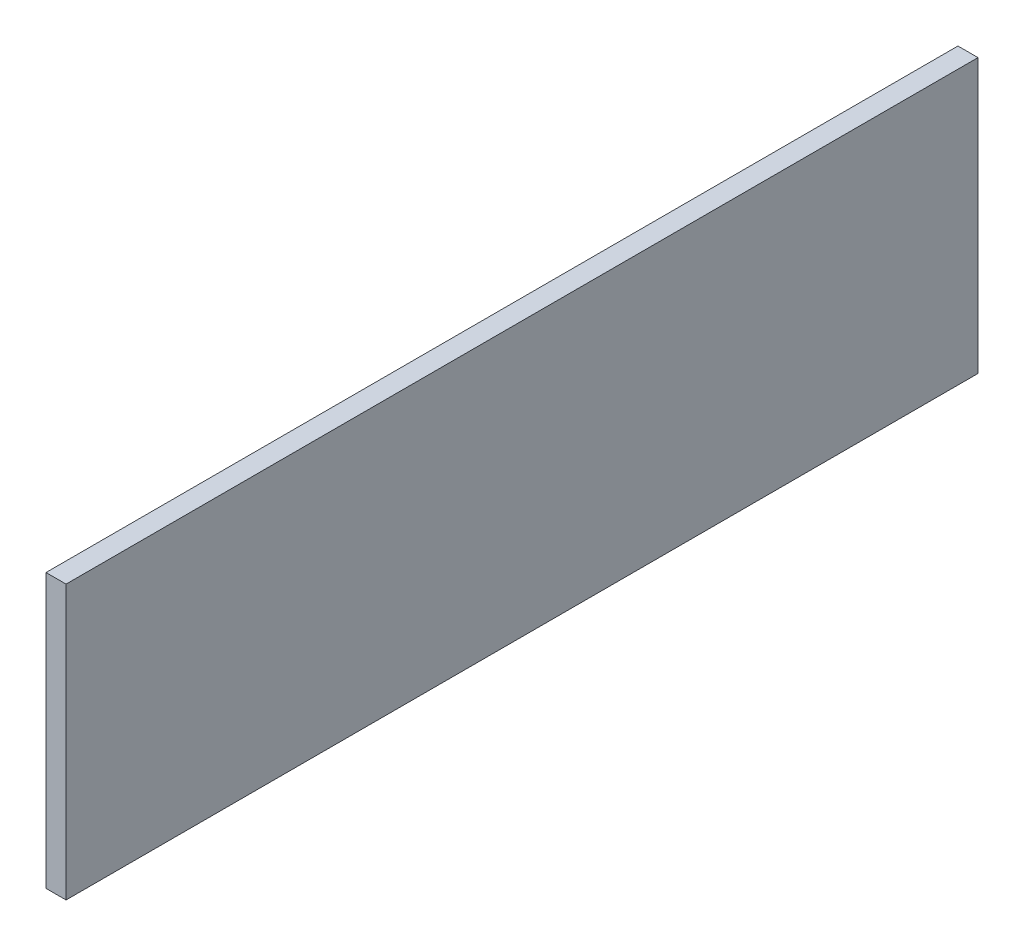
from build123d import *

# Parameters (mm, degrees)
SKETCH1_W           = 254
SKETCH1_H           = 76.2
BOSS_EXTRUDE1_DEPTH = 5.588


with BuildPart() as part:
    # Sketch1 → Boss-Extrude1 (new body)
    with BuildSketch(Plane(origin=(0, 0, 0), x_dir=(0, 0, -1), z_dir=(1, 0, 0))):
        Rectangle(SKETCH1_W, SKETCH1_H)
    extrude(amount=BOSS_EXTRUDE1_DEPTH)


solid = part.part
